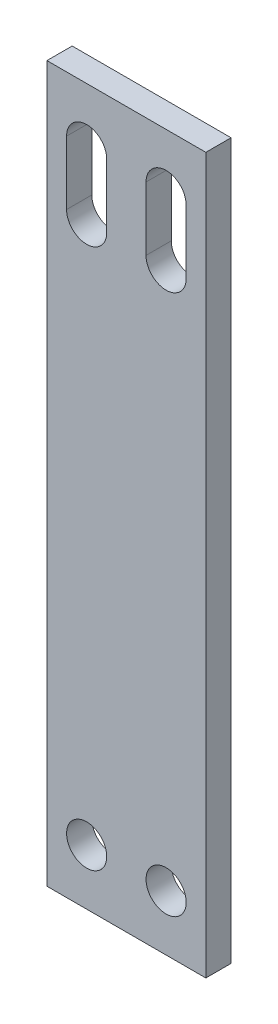
from build123d import *

# Parameters (mm, degrees)
SKETCH1_W           = 20
SKETCH1_H           = 90
SKETCH1_R           = 2.5273
BOSS_EXTRUDE1_DEPTH = 3.175


with BuildPart() as part:
    # Sketch1 → Boss-Extrude1 (new body)
    with BuildSketch(Plane.XY):
        with Locations((10, 45)):
            Rectangle(SKETCH1_W, SKETCH1_H)
        with Locations((5, 7)):
            Circle(SKETCH1_R, mode=Mode.SUBTRACT)
        with Locations((15, 7)):
            Circle(SKETCH1_R, mode=Mode.SUBTRACT)
        with BuildLine():
            Line((7.5273, 83), (7.5273, 75))
            ThreePointArc((7.5273, 75), (5, 72.4727), (2.4727, 75))
            Line((2.4727, 75), (2.4727, 83))
            ThreePointArc((2.4727, 83), (5, 85.5273), (7.5273, 83))
        make_face(mode=Mode.SUBTRACT)
        with BuildLine():
            Line((12.4727, 75), (12.4727, 83))
            ThreePointArc((12.4727, 83), (15, 85.5273), (17.5273, 83))
            Line((17.5273, 83), (17.5273, 75))
            ThreePointArc((17.5273, 75), (15, 72.4727), (12.4727, 75))
        make_face(mode=Mode.SUBTRACT)
    extrude(amount=BOSS_EXTRUDE1_DEPTH)


solid = part.part
